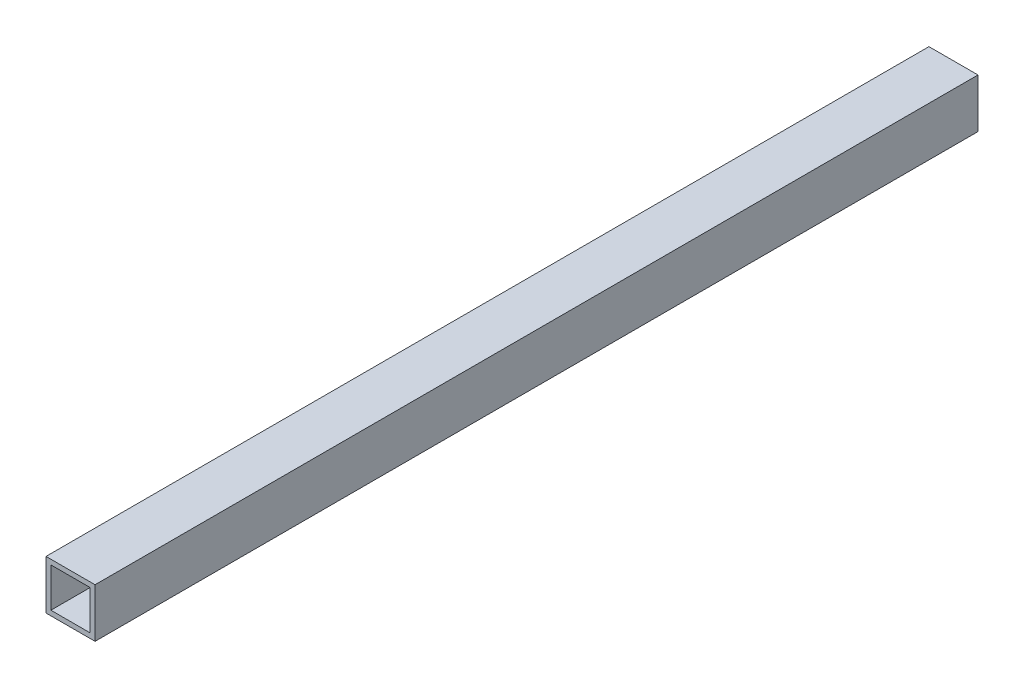
from build123d import *

# Parameters (mm, degrees)
SZKIC1_W                    = 10
SZKIC1_H                    = 10
SZKIC1_W_2                  = 8
SZKIC1_H_2                  = 8
DODANIE_WYCI_GNI_CIE1_DEPTH = 180


with BuildPart() as part:
    # Szkic1 → Dodanie-wyciągnięcie1 (new body)
    with BuildSketch(Plane.XY):
        Rectangle(SZKIC1_W, SZKIC1_H)
        Rectangle(SZKIC1_W_2, SZKIC1_H_2, mode=Mode.SUBTRACT)
    extrude(amount=DODANIE_WYCI_GNI_CIE1_DEPTH)


solid = part.part
